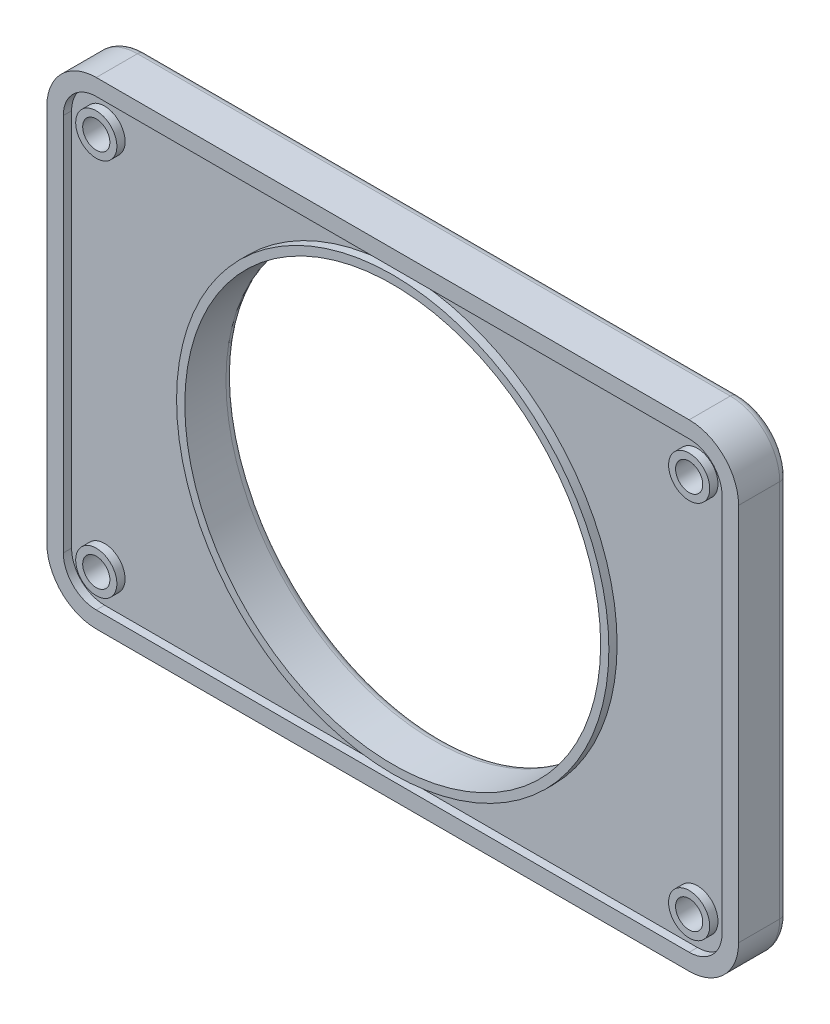
from build123d import *

# Parameters (mm, degrees)
SKETCH_1_R          = 25.25
EXTRUDE_1_DEPTH     = 5
SKETCH_2_R          = 23.85
EXTRUDE_2_DEPTH     = 1
CHAMFER_2_SIZE      = 0.5
CUT_EXTRUDE_1_DEPTH = 1
SKETCH_4_R          = 26.25
SKETCH_4_R_2        = 25.25
EXTRUDE_3_DEPTH     = 1
SKETCH_5_R          = 2.5
EXTRUDE_4_DEPTH     = 1
SKETCH_6_R          = 1.65
CUT_EXTRUDE_2_DEPTH = 3.5
FILLET_2_R          = 1


with BuildPart() as part:
    # 草图1 → 凸台-拉伸1 (new body)
    with BuildSketch(Plane.XY):
        with BuildLine():
            Line((-36, 29), (36, 29))
            ThreePointArc((36, 29), (40.242640687, 27.242640687), (42, 23))
            Line((42, 23), (42, -23))
            ThreePointArc((42, -23), (40.242640687, -27.242640687), (36, -29))
            Line((36, -29), (-36, -29))
            ThreePointArc((-36, -29), (-40.242640687, -27.242640687), (-42, -23))
            Line((-42, -23), (-42, 23))
            ThreePointArc((-42, 23), (-40.242640687, 27.242640687), (-36, 29))
        make_face()
        Circle(SKETCH_1_R, mode=Mode.SUBTRACT)
    extrude(amount=EXTRUDE_1_DEPTH)

    # 草图2 → 凸台-拉伸2 (add)
    with BuildSketch(Plane.XY.offset(5)):
        with BuildLine():
            Line((36, 29), (-36, 29))
            ThreePointArc((-36, 29), (-40.242640687, 27.242640687), (-42, 23))
            Line((-42, 23), (-42, -23))
            ThreePointArc((-42, -23), (-40.242640687, -27.242640687), (-36, -29))
            Line((-36, -29), (36, -29))
            ThreePointArc((36, -29), (40.242640687, -27.242640687), (42, -23))
            Line((42, -23), (42, 23))
            ThreePointArc((42, 23), (40.242640687, 27.242640687), (36, 29))
        make_face()
        Circle(SKETCH_2_R, mode=Mode.SUBTRACT)
    extrude(amount=EXTRUDE_2_DEPTH)

    # 倒角2
    chamfer_2_edges = [part.edges().sort_by_distance(p)[0] for p in [
        (-23.85, 0, 5),
    ]]
    chamfer(chamfer_2_edges, length=CHAMFER_2_SIZE)

    # 草图3 → 切除-拉伸1 (cut)
    with BuildSketch(Plane.XY.offset(6)):
        with BuildLine():
            Line((36, 27), (-36, 27))
            ThreePointArc((-36, 27), (-38.828427125, 25.828427125), (-40, 23))
            Line((-40, 23), (-40, -23))
            ThreePointArc((-40, -23), (-38.828427125, -25.828427125), (-36, -27))
            Line((-36, -27), (36, -27))
            ThreePointArc((36, -27), (38.828427125, -25.828427125), (40, -23))
            Line((40, -23), (40, 23))
            ThreePointArc((40, 23), (38.828427125, 25.828427125), (36, 27))
        make_face()
    extrude(amount=-CUT_EXTRUDE_1_DEPTH, mode=Mode.SUBTRACT)

    # 草图4 → 凸台-拉伸3 (add)
    with BuildSketch(Plane.XY.offset(5)):
        Circle(SKETCH_4_R)
        Circle(SKETCH_4_R_2, mode=Mode.SUBTRACT)
    extrude(amount=EXTRUDE_3_DEPTH)

    # 草图5 → 凸台-拉伸4 (add)
    with BuildSketch(Plane.XY.offset(5)):
        with Locations((36, 23)):
            Circle(SKETCH_5_R)
        with Locations(Location((36, -23, 0), (0, 0, 180))):
            Circle(SKETCH_5_R)
        with Locations(Location((-36, 23, 0), (0, 0, 180))):
            Circle(SKETCH_5_R)
        with Locations((-36, -23)):
            Circle(SKETCH_5_R)
    extrude(amount=EXTRUDE_4_DEPTH)

    # 草图6 → 切除-拉伸2 (cut)
    with BuildSketch(Plane.XY.offset(6)):
        with Locations((36, 23)):
            Circle(SKETCH_6_R)
        with Locations(Location((36, -23, 0), (0, 0, 180))):
            Circle(SKETCH_6_R)
        with Locations(Location((-36, 23, 0), (0, 0, 180))):
            Circle(SKETCH_6_R)
        with Locations((-36, -23)):
            Circle(SKETCH_6_R)
    extrude(amount=-CUT_EXTRUDE_2_DEPTH, mode=Mode.SUBTRACT)

    # 圆角2
    fillet_2_edges = [part.edges().sort_by_distance(p)[0] for p in [
        (-42, 0, 0),
        (-40.242640687, 27.242640687, 0),
        (0, 29, 0),
        (40.242640687, 27.242640687, 0),
        (-25.25, 0, 0),
        (42, 0, 0),
        (40.242640687, -27.242640687, 0),
        (0, -29, 0),
        (-40.242640687, -27.242640687, 0),
    ]]
    fillet(fillet_2_edges, radius=FILLET_2_R)


solid = part.part
